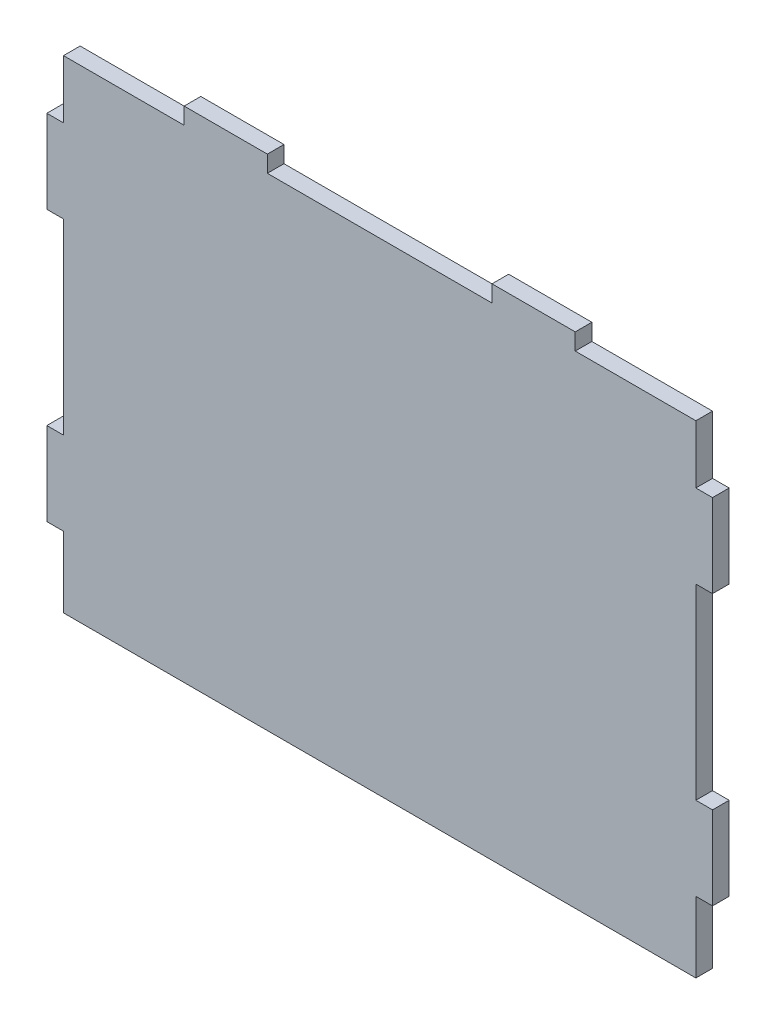
from build123d import *

# Parameters (mm, degrees)
SKETCH1_W           = 193.04
SKETCH1_H           = 147.32
SKETCH1_W_2         = 25.4
SKETCH1_H_2         = 5.08
SKETCH1_W_3         = 5.08
SKETCH1_H_3         = 25.4
BOSS_EXTRUDE2_DEPTH = 5.08


with BuildPart() as part:
    # Sketch1 → Boss-Extrude2 (new body)
    with BuildSketch(Plane.XY):
        with Locations((0, 22.86)):
            Rectangle(SKETCH1_W, SKETCH1_H)
        with Locations((-46.99, 99.06)):
            Rectangle(SKETCH1_W_2, SKETCH1_H_2)
        with Locations((46.99, 99.06)):
            Rectangle(SKETCH1_W_2, SKETCH1_H_2)
        with Locations((99.06, 66.04)):
            Rectangle(SKETCH1_W_3, SKETCH1_H_3)
        with Locations((99.06, -16.51)):
            Rectangle(SKETCH1_W_3, SKETCH1_H_3)
        with Locations((-99.06, -16.51)):
            Rectangle(SKETCH1_W_3, SKETCH1_H_3)
        with Locations((-99.06, 66.04)):
            Rectangle(SKETCH1_W_3, SKETCH1_H_3)
    extrude(amount=BOSS_EXTRUDE2_DEPTH)


solid = part.part
